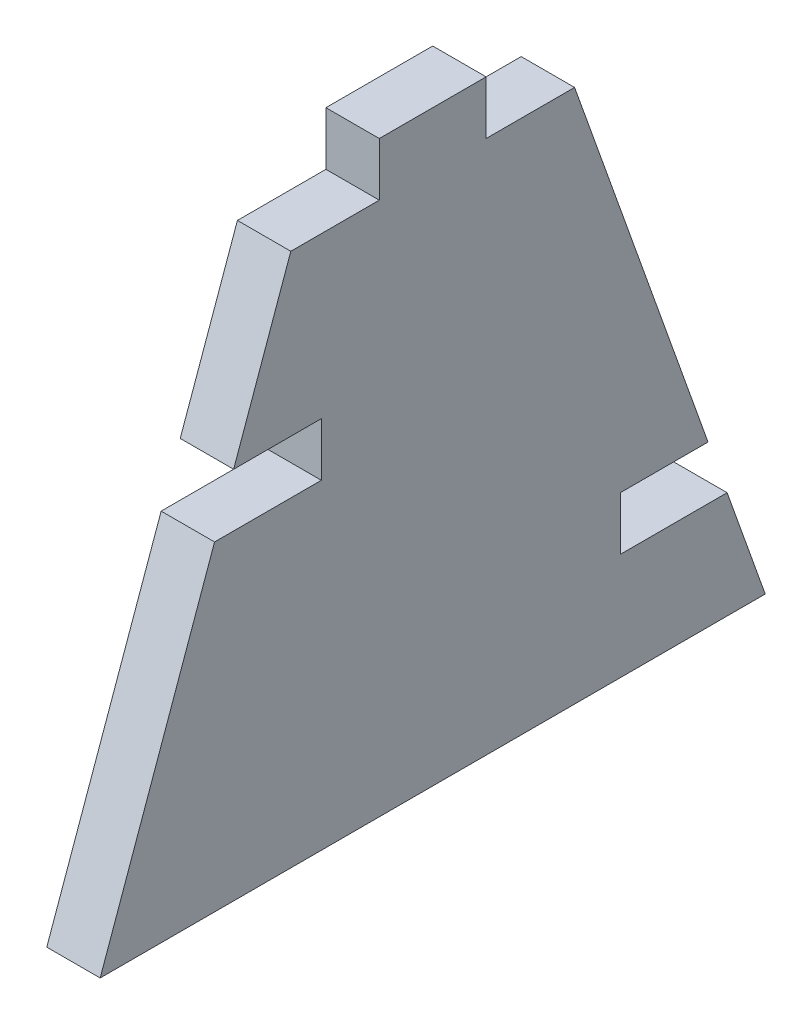
from build123d import *

# Parameters (mm, degrees)
BOSS_EXTRUDE1_DEPTH = 254


with BuildPart() as part:
    # Sketch2 → Boss-Extrude1 (new body)
    with BuildSketch(Plane(origin=(0, 0, 0), x_dir=(0, 0, -1), z_dir=(1, 0, 0))):
        Polygon((587.895207134, 0), (-2575.208952597, 0), (-2031.17524425, 1524), (-1523.17524425, 1524), (-1523.17524425, 1778), (-1940.502959526, 1778), (-1668.486105353, 2540), (-1247.656872732, 2540), (-1247.656872732, 2794), (-739.656872732, 2794), (-739.656872732, 2540), (-318.827640111, 2540), (315.87835296, 762), (-101.449362315, 762), (-101.449362315, 508), (406.550637685, 508), align=None)
    extrude(amount=BOSS_EXTRUDE1_DEPTH)


solid = part.part
